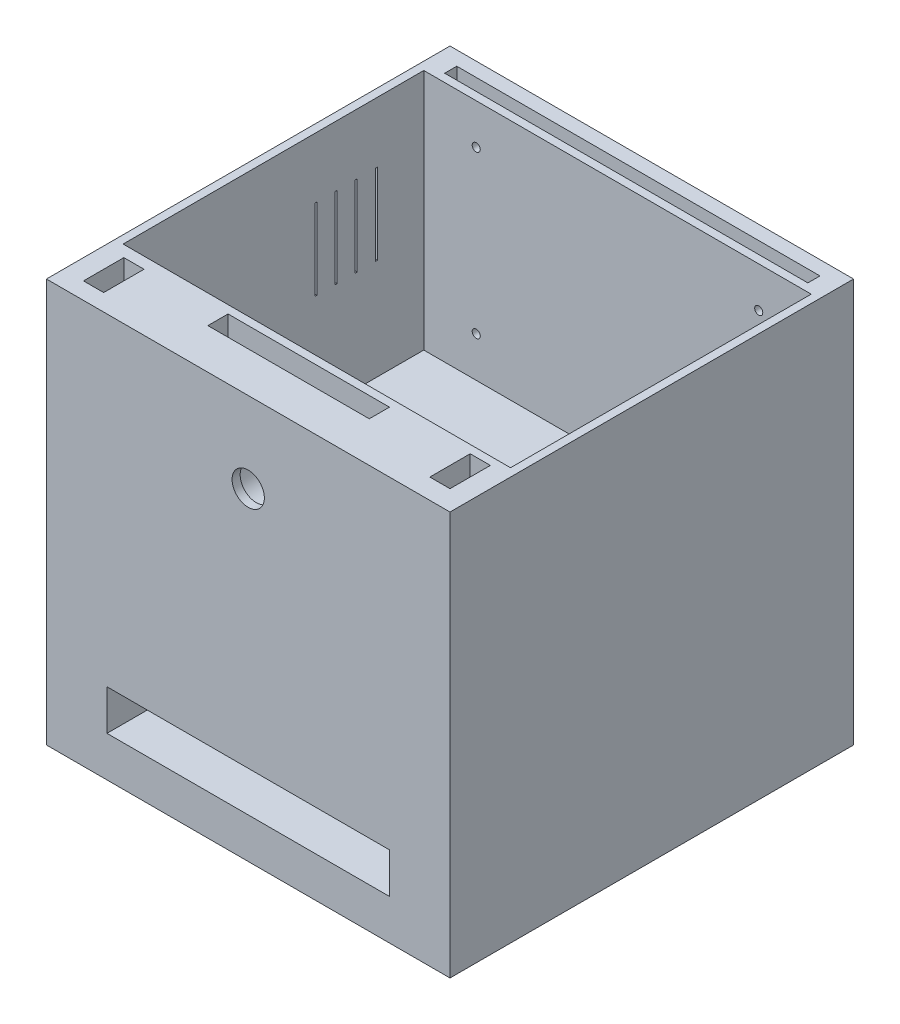
from build123d import *

# Parameters (mm, degrees)
SKETCH1_W           = 100
SKETCH1_H           = 100
BOSS_EXTRUDE1_DEPTH = 100
SKETCH2_W           = 90
SKETCH2_H           = 70
CUT_EXTRUDE1_DEPTH  = 50
SKETCH3_W           = 25
SKETCH3_H           = 25
CUT_EXTRUDE2_DEPTH  = 30
SKETCH4_W           = 70
SKETCH4_H           = 10
CUT_EXTRUDE3_DEPTH  = 70
SKETCH9_W           = 0.5
SKETCH9_H           = 20
CUT_EXTRUDE7_DEPTH  = 10
SKETCH15_W          = 40
SKETCH15_H          = 5
CUT_EXTRUDE8_DEPTH  = 5
SKETCH16_W          = 5
SKETCH16_H          = 10
CUT_EXTRUDE9_DEPTH  = 5
SKETCH17_W          = 5
SKETCH17_H          = 10
CUT_EXTRUDE10_DEPTH = 5
SKETCH20_W          = 70
SKETCH20_H          = 10
CUT_EXTRUDE11_DEPTH = 20
SKETCH21_W          = 90
SKETCH21_H          = 3
CUT_EXTRUDE12_DEPTH = 5
SKETCH23_W          = 90
SKETCH23_H          = 70
CUT_EXTRUDE14_DEPTH = 10
SKETCH26_R          = 1
CUT_EXTRUDE16_DEPTH = 10
SKETCH29_R          = 4
CUT_EXTRUDE20_DEPTH = 11
CUT_EXTRUDE21_START = -2
SKETCH30_R          = 5.5
CUT_EXTRUDE21_DEPTH = 20
SKETCH31_W          = 96
SKETCH31_H          = 74.5
CUT_EXTRUDE22_DEPTH = 60


with BuildPart() as part:
    # Sketch1 → Boss-Extrude1 (new body)
    with BuildSketch(Plane.XY):
        with Locations((50, -50)):
            Rectangle(SKETCH1_W, SKETCH1_H)
    extrude(amount=BOSS_EXTRUDE1_DEPTH)

    # Sketch2 → Cut-Extrude1 (cut)
    with BuildSketch(Plane(origin=(0, 0, 0), x_dir=(1, 0, 0), z_dir=(0, 1, 0))):
        with Locations((50, -45)):
            Rectangle(SKETCH2_W, SKETCH2_H)
    extrude(amount=-CUT_EXTRUDE1_DEPTH, mode=Mode.SUBTRACT)

    # Sketch3 → Cut-Extrude2 (cut)
    with BuildSketch(Plane(origin=(0, -50, 0), x_dir=(1, 0, 0), z_dir=(0, 1, 0))):
        with Locations((50, -55)):
            Rectangle(SKETCH3_W, SKETCH3_H)
    extrude(amount=-CUT_EXTRUDE2_DEPTH, mode=Mode.SUBTRACT)

    # Sketch4 → Cut-Extrude3 (cut)
    with BuildSketch(Plane.XY.offset(100)):
        with Locations((50, -85)):
            Rectangle(SKETCH4_W, SKETCH4_H)
    extrude(amount=-CUT_EXTRUDE3_DEPTH, mode=Mode.SUBTRACT)

    # Sketch9 → Cut-Extrude7 (cut)
    with BuildSketch(Plane.ZY):
        with Locations((20.25, -25)):
            Rectangle(SKETCH9_W, SKETCH9_H)
        with Locations((25.25, -25)):
            Rectangle(SKETCH9_W, SKETCH9_H)
        with Locations((30.25, -25)):
            Rectangle(SKETCH9_W, SKETCH9_H)
        with Locations((35.25, -25)):
            Rectangle(SKETCH9_W, SKETCH9_H)
    extrude(amount=-CUT_EXTRUDE7_DEPTH, mode=Mode.SUBTRACT)

    # Sketch15 → Cut-Extrude8 (cut)
    with BuildSketch(Plane(origin=(0, 0, 0), x_dir=(1, 0, 0), z_dir=(0, 1, 0))):
        with Locations((50, -87.5)):
            Rectangle(SKETCH15_W, SKETCH15_H)
    extrude(amount=-CUT_EXTRUDE8_DEPTH, mode=Mode.SUBTRACT)

    # Sketch16 → Cut-Extrude9 (cut)
    with BuildSketch(Plane(origin=(0, 0, 0), x_dir=(1, 0, 0), z_dir=(0, 1, 0))):
        with Locations((7.5, -90.818061544)):
            Rectangle(SKETCH16_W, SKETCH16_H)
    extrude(amount=-CUT_EXTRUDE9_DEPTH, mode=Mode.SUBTRACT)

    # Sketch17 → Cut-Extrude10 (cut)
    with BuildSketch(Plane(origin=(0, 0, 0), x_dir=(1, 0, 0), z_dir=(0, 1, 0))):
        with Locations((92.5, -90)):
            Rectangle(SKETCH17_W, SKETCH17_H)
    extrude(amount=-CUT_EXTRUDE10_DEPTH, mode=Mode.SUBTRACT)

    # Sketch20 → Cut-Extrude11 (cut)
    with BuildSketch(Plane.XY.offset(30)):
        with Locations((50, -85)):
            Rectangle(SKETCH20_W, SKETCH20_H)
    extrude(amount=-CUT_EXTRUDE11_DEPTH, mode=Mode.SUBTRACT)

    # Sketch21 → Cut-Extrude12 (cut)
    with BuildSketch(Plane(origin=(0, 0, 0), x_dir=(1, 0, 0), z_dir=(0, 1, 0))):
        with Locations((50.175260559, -5)):
            Rectangle(SKETCH21_W, SKETCH21_H)
    extrude(amount=-CUT_EXTRUDE12_DEPTH, mode=Mode.SUBTRACT)

    # Sketch23 → Cut-Extrude14 (cut)
    with BuildSketch(Plane(origin=(0, -50, 0), x_dir=(1, 0, 0), z_dir=(0, 1, 0))):
        with Locations((50, -45)):
            Rectangle(SKETCH23_W, SKETCH23_H)
    extrude(amount=-CUT_EXTRUDE14_DEPTH, mode=Mode.SUBTRACT)

    # Sketch26 → Cut-Extrude16 (cut)
    with BuildSketch(Plane.XY.offset(10)):
        with Locations((15, -10)):
            Circle(SKETCH26_R)
        with Locations((85, -10)):
            Circle(SKETCH26_R)
        with Locations((85, -50)):
            Circle(SKETCH26_R)
        with Locations((15, -50)):
            Circle(SKETCH26_R)
    extrude(amount=-CUT_EXTRUDE16_DEPTH, mode=Mode.SUBTRACT)

    # Sketch29 → Cut-Extrude20 (cut)
    with BuildSketch(Plane.XY.offset(100)):
        with Locations((50, -20)):
            Circle(SKETCH29_R)
    extrude(amount=-CUT_EXTRUDE20_DEPTH, mode=Mode.SUBTRACT)

    # Sketch30 → Cut-Extrude21 (cut)
    with BuildSketch(Plane.XY.offset(100).offset(CUT_EXTRUDE21_START)):
        with Locations((50, -20)):
            Circle(SKETCH30_R)
    extrude(amount=-CUT_EXTRUDE21_DEPTH, mode=Mode.SUBTRACT)

    # Sketch31 → Cut-Extrude22 (cut)
    with BuildSketch(Plane(origin=(0, 0, 0), x_dir=(1, 0, 0), z_dir=(0, 1, 0))):
        with Locations((50, -45.75)):
            Rectangle(SKETCH31_W, SKETCH31_H)
    extrude(amount=-CUT_EXTRUDE22_DEPTH, mode=Mode.SUBTRACT)


solid = part.part
